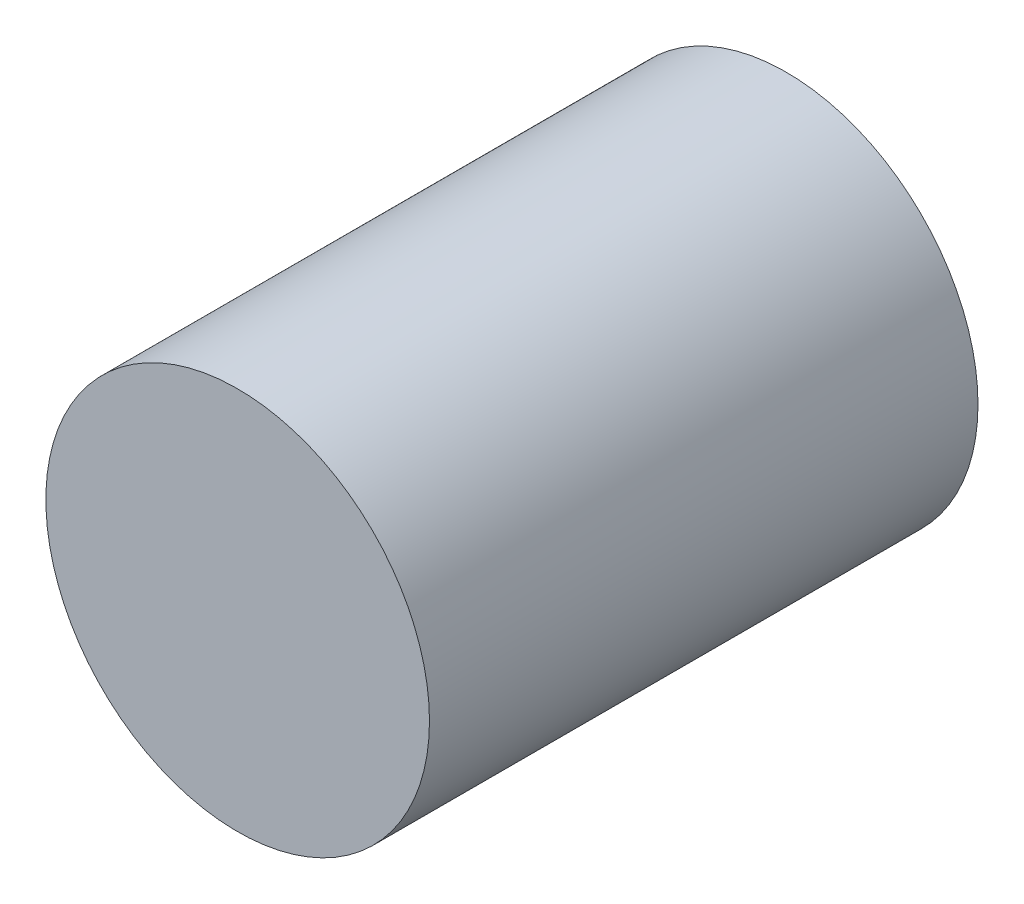
from build123d import *

# Parameters (mm, degrees)
SKETCH1_W             = 128.922622712
SKETCH1_H             = 108.547542538
SKETCH1_W_2           = 124.922622712
SKETCH1_H_2           = 104.547542538
BOSS_EXTRUDE1_DEPTH   = 50
SKETCH2_R             = 48.496570744
BOSS_EXTRUDE2_DEPTH   = 50
SKETCH3_R             = 6.994110628
BOSS_EXTRUDE3_DEPTH   = 20
SKETCH3_R_2           = 6.120691225
BOSS_EXTRUDE3_2_DEPTH = 20


with BuildPart() as part:
    # Sketch1 → Boss-Extrude1 (new body)
    with BuildSketch(Plane.XY):
        Rectangle(SKETCH1_W, SKETCH1_H)
        Rectangle(SKETCH1_W_2, SKETCH1_H_2, mode=Mode.SUBTRACT)
    extrude(amount=BOSS_EXTRUDE1_DEPTH)


with BuildPart() as body_2:
    # Sketch2 → Boss-Extrude2 (new body)
    with BuildSketch(Plane.XY):
        with Locations(Location((0, 0, 0), (0, 0, 180))):
            Circle(SKETCH2_R)
    extrude(amount=BOSS_EXTRUDE2_DEPTH)


with BuildPart() as body_3:
    # Sketch3 → Boss-Extrude3 (new body)
    with BuildSketch(Plane.XY):
        with Locations((-51.126362865, 41.516845757)):
            Circle(SKETCH3_R)
    extrude(amount=BOSS_EXTRUDE3_DEPTH)


with BuildPart() as body_4:
    # Sketch3 → Boss-Extrude3 2 (new body)
    with BuildSketch(Plane.XY):
        with Locations((46.461548735, 43.755956539)):
            Circle(SKETCH3_R_2)
    extrude(amount=BOSS_EXTRUDE3_2_DEPTH)


solid = body_3.part
